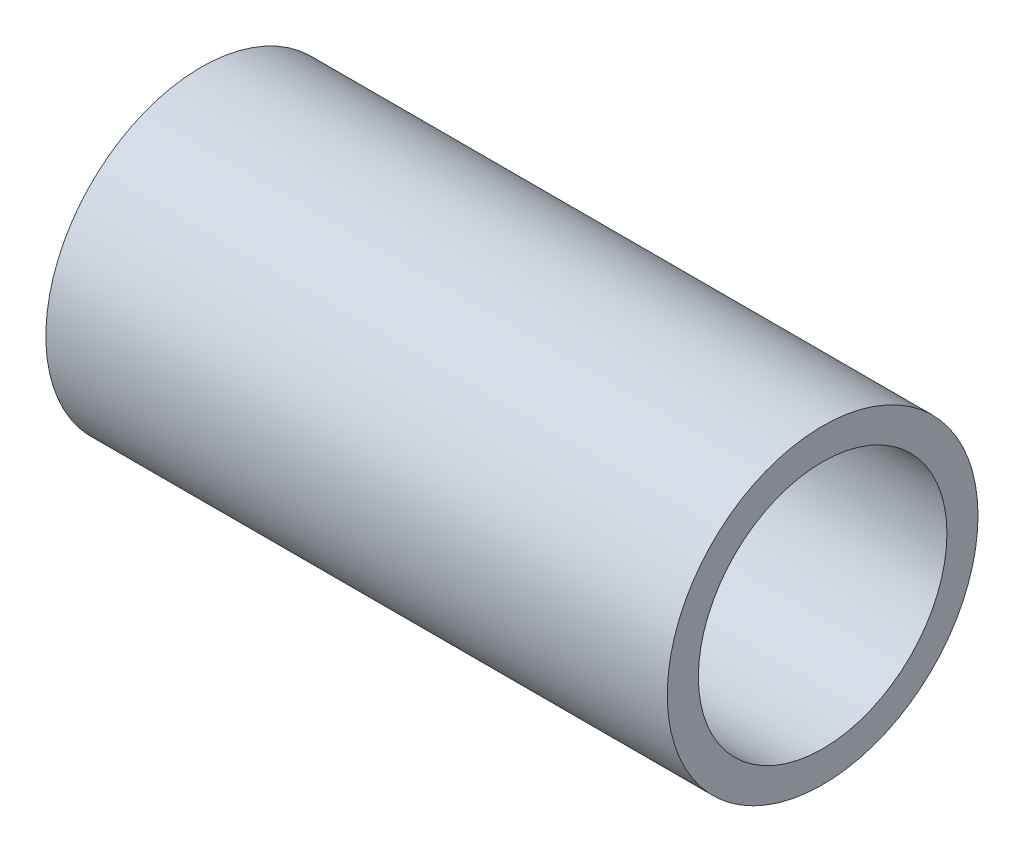
from build123d import *

# Parameters (mm, degrees)
SKETCH1_R           = 7.9375
SKETCH1_R_2         = 6.35
BOSS_EXTRUDE1_DEPTH = 31.75


with BuildPart() as part:
    # Sketch1 → Boss-Extrude1 (new body)
    with BuildSketch(Plane(origin=(0, 0, 0), x_dir=(0, 0, -1), z_dir=(1, 0, 0))):
        Circle(SKETCH1_R)
        Circle(SKETCH1_R_2, mode=Mode.SUBTRACT)
    extrude(amount=BOSS_EXTRUDE1_DEPTH)


solid = part.part
